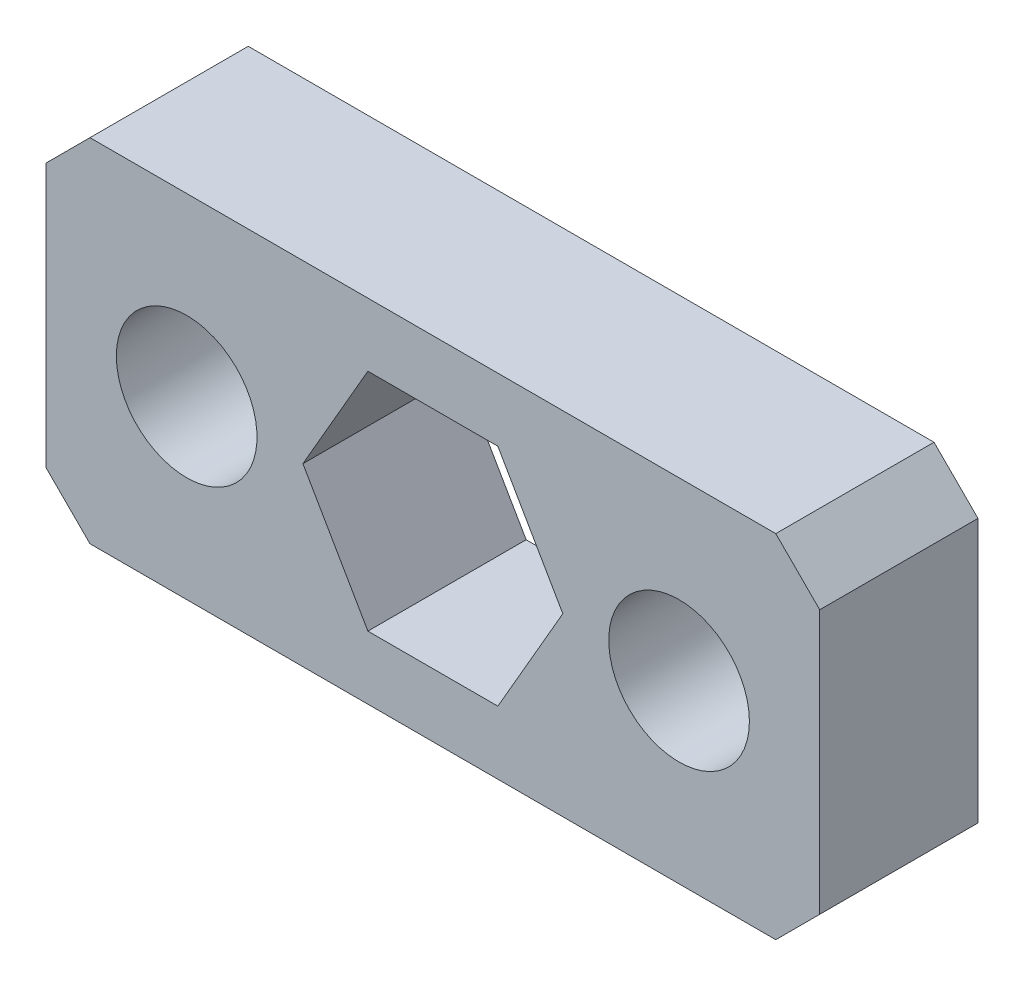
from build123d import *

# Parameters (mm, degrees)
MODEL_R             = 4
BOSS_EXTRUDE1_DEPTH = 9


with BuildPart() as part:
    # Model → Boss-Extrude1 (new body)
    with BuildSketch(Plane.XY):
        Polygon((-19.5, 20), (19.5, 20), (22, 17.5), (22, 2.5), (19.5, 0), (-19.5, 0), (-22, 2.5), (-22, 17.5), align=None)
        with Locations((14, 10)):
            Circle(MODEL_R, mode=Mode.SUBTRACT)
        with Locations(Location((-14, 10, 0), (0, 0, 180))):
            Circle(MODEL_R, mode=Mode.SUBTRACT)
        Polygon((7.390083446, 10), (3.695041723, 16.4), (-3.695041723, 16.4), (-7.390083446, 10), (-3.695041723, 3.6), (3.695041723, 3.6), align=None, mode=Mode.SUBTRACT)
    extrude(amount=BOSS_EXTRUDE1_DEPTH)


solid = part.part
